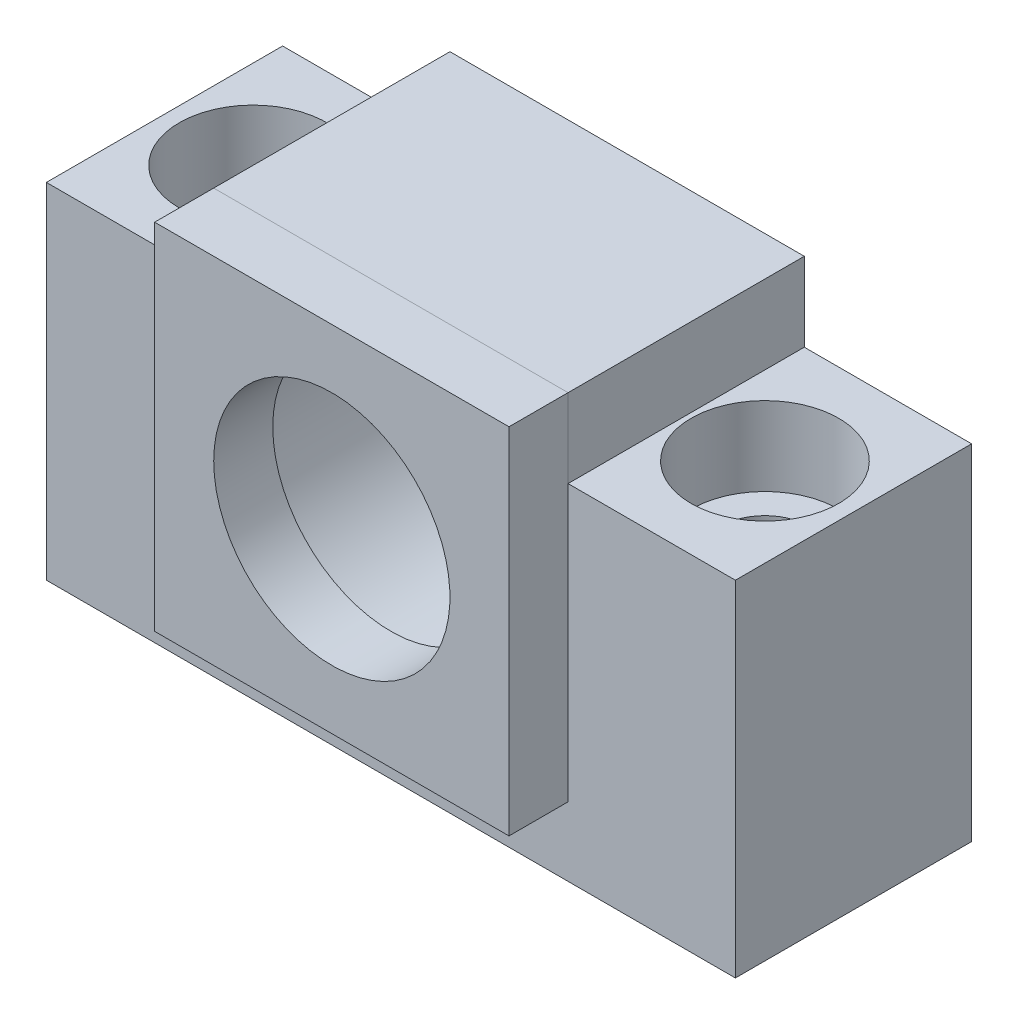
from build123d import *

# Parameters (mm, degrees)
SKETCH_1_W                  = 70
SKETCH_1_H                  = 43
EXTRUDE_1_DEPTH             = 24
SKETCH_2_W                  = 17
SKETCH_2_H                  = 8
CUT_EXTRUDE_1_DEPTH         = 86.586213843
SKETCH_3_R                  = 15
CUT_EXTRUDE_2_DEPTH         = 18
SKETCH_4_R                  = 12
CUT_EXTRUDE_3_DEPTH         = 85.1011296
SKETCH_5_W                  = 36
SKETCH_5_H                  = 36
EXTRUDE_2_DEPTH             = 6
SKETCH_6_R                  = 12
CUT_EXTRUDE_4_DEPTH         = 86.586213843
HOLE_WIZARD_M8_1_AT_2_COUNT = 2
HOLE_WIZARD_M8_1_AT_2_PITCH = 52


with BuildPart() as part:
    # 草图1 → 凸台-拉伸1 (new body)
    with BuildSketch(Plane.XY):
        with Locations((35, 21.5)):
            Rectangle(SKETCH_1_W, SKETCH_1_H)
    extrude(amount=EXTRUDE_1_DEPTH)

    # 草图2 → 切除-拉伸1 (cut, through all)
    with BuildSketch(Plane.XY.offset(24)):
        with Locations((8.5, 39)):
            Rectangle(SKETCH_2_W, SKETCH_2_H)
        with Locations((61.5, 39)):
            Rectangle(SKETCH_2_W, SKETCH_2_H)
    extrude(amount=-CUT_EXTRUDE_1_DEPTH, mode=Mode.SUBTRACT)

    # 草图3 → 切除-拉伸2 (cut)
    with BuildSketch(Plane.XY.offset(24)):
        with Locations((35, 25)):
            Circle(SKETCH_3_R)
    extrude(amount=-CUT_EXTRUDE_2_DEPTH, mode=Mode.SUBTRACT)

    # 草图4 → 切除-拉伸3 (cut, through all)
    with BuildSketch(Plane.XY.offset(6)):
        with Locations((35, 25)):
            Circle(SKETCH_4_R)
    extrude(amount=-CUT_EXTRUDE_3_DEPTH, mode=Mode.SUBTRACT)

    # 草图7 → M8 六角凹头螺钉的柱形沉头孔1 (revolve, cut)
    with BuildSketch(Plane(origin=(61, 35, 12), x_dir=(0, 0, 1), z_dir=(1, 0, 0))):
        Polygon((0, 0), (0, 35), (4.5, 35), (4.5, 8), (7.5, 8), (7.5, 0), align=None)
    hole_wizard_m8_1 = revolve(axis=Axis((61, 41.35, 12), (0, -1, 0)), mode=Mode.SUBTRACT)

    # M8 六角凹头螺钉的柱形沉头孔1 at 2: M8 六角凹头螺钉的柱形沉头孔1 ×2
    with Locations(*[(-i * HOLE_WIZARD_M8_1_AT_2_PITCH, 0, 0) for i in range(1, HOLE_WIZARD_M8_1_AT_2_COUNT)]):
        add(hole_wizard_m8_1, mode=Mode.SUBTRACT)


with BuildPart() as body_2:
    # 草图5 → 凸台-拉伸2 (new body)
    with BuildSketch(Plane.XY.offset(24)):
        with Locations((35, 25)):
            Rectangle(SKETCH_5_W, SKETCH_5_H)
    extrude(amount=EXTRUDE_2_DEPTH)

    # 草图6 → 切除-拉伸4 (cut, through all)
    with BuildSketch(Plane(origin=(0, 0, 24), x_dir=(-1, 0, 0), z_dir=(0, 0, -1))):
        with Locations((-35, 25)):
            Circle(SKETCH_6_R)
    extrude(amount=-CUT_EXTRUDE_4_DEPTH, mode=Mode.SUBTRACT)


solid = Compound([part.part, body_2.part])
